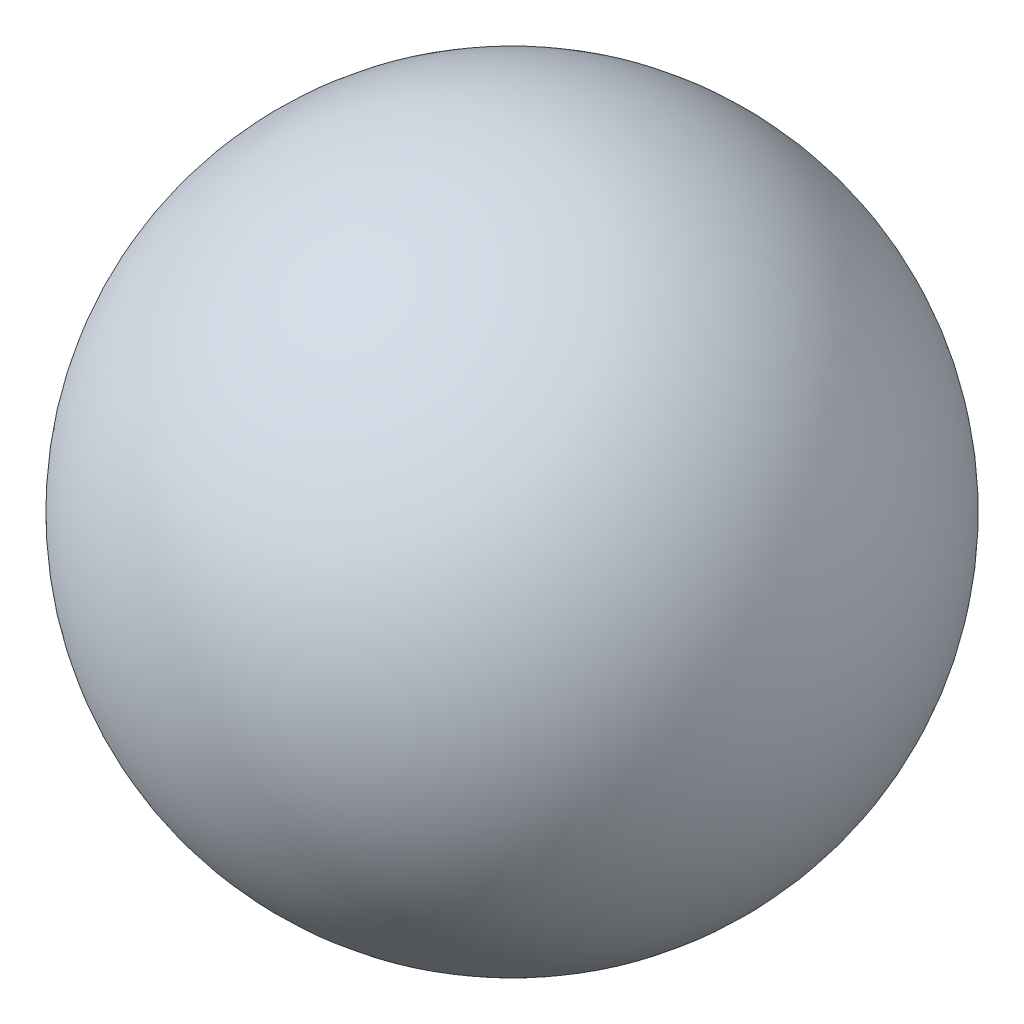
from build123d import *


with BuildPart() as part:
    # Schizzo1 → Rivoluzione1 (revolve)
    with BuildSketch(Plane.XY):
        with BuildLine():
            Line((0, 4), (0, -4))
            ThreePointArc((0, -4), (-4, 0), (0, 4))
        make_face()
    revolve(axis=Axis((0, 4, 0), (0, -1, 0)))


solid = part.part
